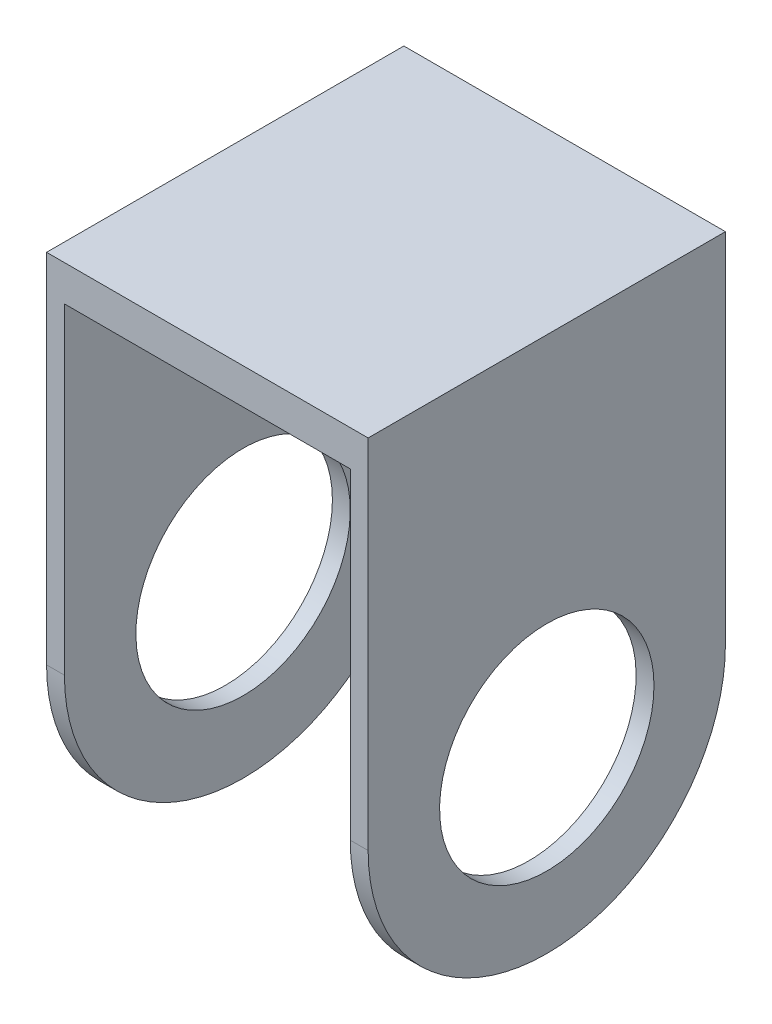
from build123d import *

# Parameters (mm, degrees)
SKETCH1_R           = 3
BOSS_EXTRUDE1_DEPTH = 9
SKETCH3_W           = 8
SKETCH3_H           = 14.926112698
CUT_EXTRUDE1_DEPTH  = 12


with BuildPart() as part:
    # Sketch1 → Boss-Extrude1 (new body)
    with BuildSketch(Plane(origin=(0, 0, 0), x_dir=(0, 0, -1), z_dir=(1, 0, 0))):
        with BuildLine():
            Line((-11.644204214, 4.399749293), (-11.644204214, 14.399749293))
            Line((-11.644204214, 14.399749293), (-1.644204214, 14.399749293))
            Line((-1.644204214, 14.399749293), (-1.644204214, 4.399749293))
            ThreePointArc((-1.644204214, 4.399749293), (-6.644204214, -0.600250707), (-11.644204214, 4.399749293))
        make_face()
        with Locations((-6.644204214, 4.399749293)):
            Circle(SKETCH1_R, mode=Mode.SUBTRACT)
    extrude(amount=BOSS_EXTRUDE1_DEPTH)

    # Sketch3 → Cut-Extrude1 (cut)
    with BuildSketch(Plane(origin=(0, 0, 1.644204214), x_dir=(-1, 0, 0), z_dir=(0, 0, -1))):
        with Locations((-4.5, 5.936692944)):
            Rectangle(SKETCH3_W, SKETCH3_H)
    extrude(amount=-CUT_EXTRUDE1_DEPTH, mode=Mode.SUBTRACT)


solid = part.part
